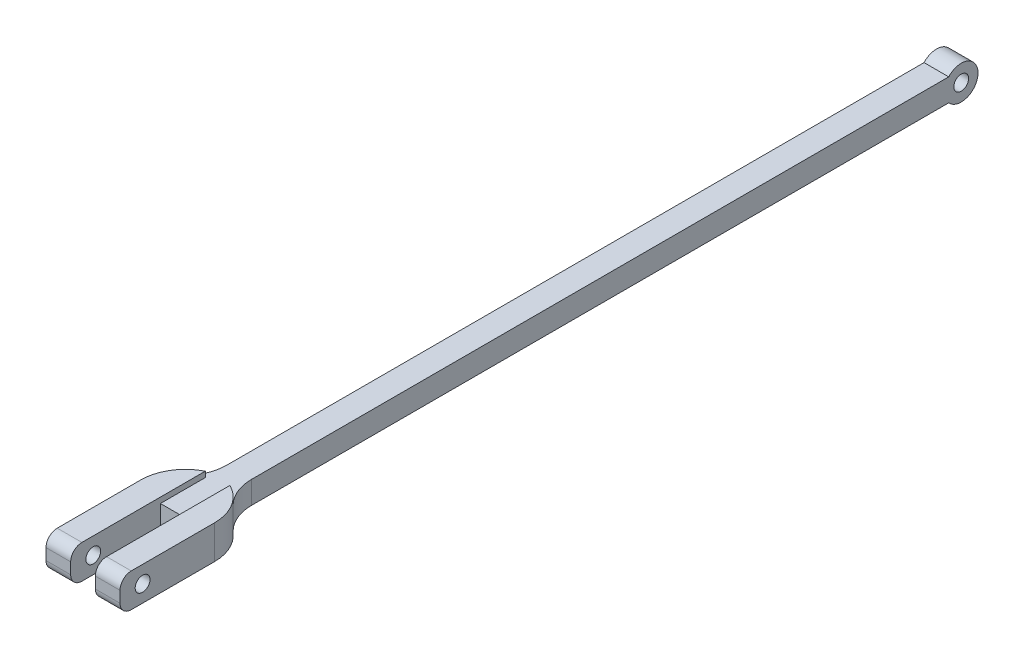
from build123d import *

# Parameters (mm, degrees)
BOSS_EXTRUDE1_DEPTH             = 241.3
BOSS_EXTRUDE1_DEPTH_BACK        = 198.12
SKETCH1_W                       = 13.97
SKETCH1_H                       = 12.758728324
BOSS_EXTRUDE2_REACH             = 243.485
SKETCH2_R                       = 9.525
BOSS_EXTRUDE2_DIRECTION_2_REACH = 243.485
SKETCH3_R                       = 4.191
CUT_EXTRUDE1_DEPTH              = 242.891662785
BOSS_EXTRUDE3_DEPTH             = 9.525
FILLET4_R                       = 25.4
FILLET5_R                       = 6.35
CUT_EXTRUDE2_DEPTH              = 294.005542012
CUT_EXTRUDE2_DEPTH_BACK         = 294.005542012
SKETCH6_R                       = 4.191


with BuildPart() as part:
    # Sketch1 → Boss-Extrude1 (new, two sides: drawn at the far end of the back side and taken through both)
    with BuildSketch(Plane.XY.offset(-BOSS_EXTRUDE1_DEPTH_BACK)):
        Rectangle(SKETCH1_W, SKETCH1_H)
    extrude(amount=BOSS_EXTRUDE1_DEPTH + BOSS_EXTRUDE1_DEPTH_BACK)

    # Boss-Extrude2: up to this face of the body (flat: up to its plane)
    boss_extrude2_end = Plane(part.part.faces().sort_by_distance((6.985, 0, 21.59))[0])
    # Sketch2 → Boss-Extrude2 (add, up to the picked face)
    with BuildSketch(Plane(origin=(0, 0, 0), x_dir=(0, 0, -1), z_dir=(1, 0, 0)), mode=Mode.PRIVATE) as boss_extrude2_sk1:
        with Locations((198.12, 0)):
            Circle(SKETCH2_R)
    boss_extrude2_tool1 = split(extrude(boss_extrude2_sk1.sketch, amount=BOSS_EXTRUDE2_REACH, mode=Mode.PRIVATE), bisect_by=boss_extrude2_end, keep=Keep.BOTH, mode=Mode.PRIVATE)
    add(boss_extrude2_tool1.solids().sort_by(Axis((0, 0, -198.12), (1, 0, 0)))[0])

    # Boss-Extrude2 direction 2: up to this face of the body (flat: up to its plane)
    boss_extrude2_direction_2_end = Plane(part.part.faces().sort_by_distance((-6.985, 0, 21.59))[0])
    # Sketch2 → Boss-Extrude2 direction 2 (add, up to the picked face)
    with BuildSketch(Plane(origin=(0, 0, 0), x_dir=(0, 0, -1), z_dir=(1, 0, 0)), mode=Mode.PRIVATE) as boss_extrude2_direction_2_sk1:
        with Locations((198.12, 0)):
            Circle(SKETCH2_R)
    boss_extrude2_direction_2_tool1 = split(extrude(boss_extrude2_direction_2_sk1.sketch, amount=-BOSS_EXTRUDE2_DIRECTION_2_REACH, mode=Mode.PRIVATE), bisect_by=boss_extrude2_direction_2_end, keep=Keep.BOTH, mode=Mode.PRIVATE)
    add(boss_extrude2_direction_2_tool1.solids().sort_by(Axis((0, 0, -198.12), (-1, 0, 0)))[0])

    # Sketch3 → Cut-Extrude1 (cut, through all)
    with BuildSketch(Plane(origin=(6.985, 0, 0), x_dir=(0, 0, -1), z_dir=(1, 0, 0))):
        with Locations((198.12, 0)):
            Circle(SKETCH3_R)
    extrude(amount=-CUT_EXTRUDE1_DEPTH, mode=Mode.SUBTRACT)

    # Sketch4 → Boss-Extrude3 (add, symmetric)
    with BuildSketch(Plane(origin=(0, 0, 0), x_dir=(1, 0, 0), z_dir=(0, 1, 0))):
        with BuildLine():
            Line((-6.985, -241.3), (-6.985, -292.1))
            Line((-6.985, -292.1), (-20.955, -292.1))
            Line((-20.955, -292.1), (-20.955, -238.518716551))
            ThreePointArc((-20.955, -238.518716551), (-17.180965419, -225.226169406), (-6.985, -215.9))
            Line((-6.985, -215.9), (-6.985, -241.3))
        make_face()
    boss_extrude3 = extrude(amount=BOSS_EXTRUDE3_DEPTH, both=True)

    # Mirror1: Boss-Extrude3 across plane
    add(boss_extrude3.mirror(Plane(origin=(0, 0, 0), x_dir=(0, 0, 1), z_dir=(1, 0, 0))))

    # Fillet4
    fillet4_edges = [part.edges().sort_by_distance(p)[0] for p in [
        (-6.985, 0, 215.9),
        (6.985, 0, 215.9),
    ]]
    fillet(fillet4_edges, radius=FILLET4_R)

    # Fillet5
    fillet5_edges = [part.edges().sort_by_distance(p)[0] for p in [
        (-13.97, -9.525, 292.1),
        (-13.97, 9.525, 292.1),
        (13.97, 9.525, 292.1),
        (13.97, -9.525, 292.1),
    ]]
    fillet(fillet5_edges, radius=FILLET5_R)

    # Sketch6 → Cut-Extrude2 (cut, two sides: drawn at the far end of the back side and taken through both)
    with BuildSketch(Plane(origin=(0, 0, 0), x_dir=(0, 0, -1), z_dir=(1, 0, 0)).offset(-CUT_EXTRUDE2_DEPTH_BACK)):
        with Locations((-279.32450026, 0)):
            Circle(SKETCH6_R)
    extrude(amount=CUT_EXTRUDE2_DEPTH + CUT_EXTRUDE2_DEPTH_BACK, mode=Mode.SUBTRACT)


solid = part.part
